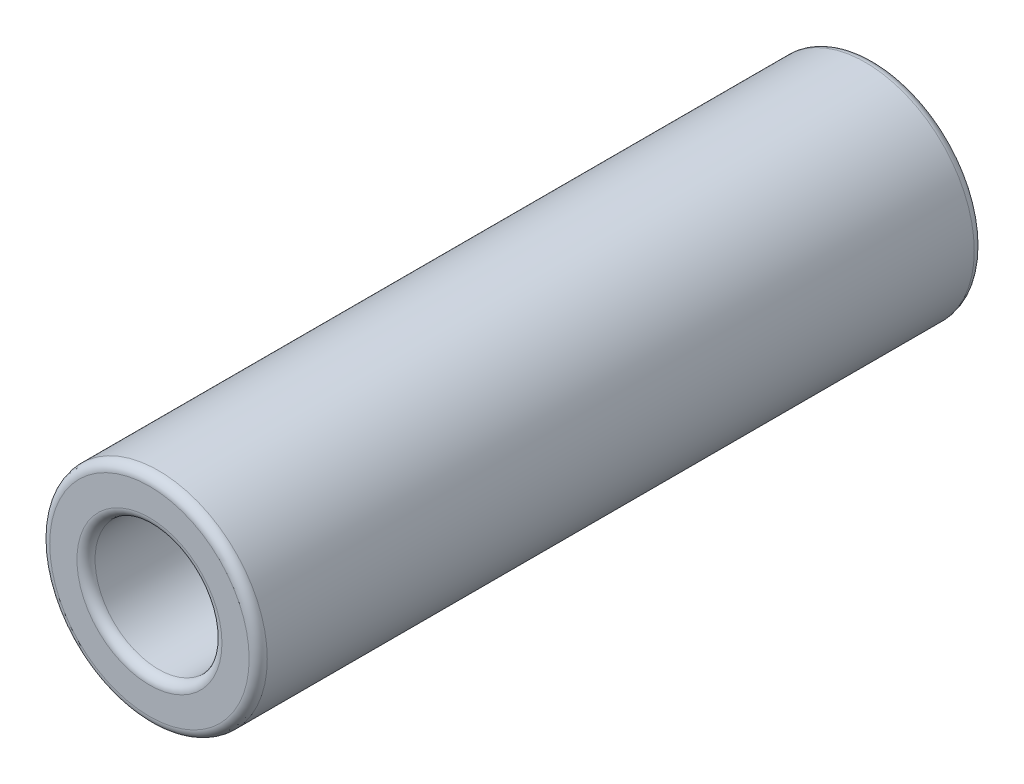
from build123d import *

# Parameters (mm, degrees)
SZKIC1_R                    = 6
SZKIC1_R_2                  = 3.5
DODANIE_WYCI_GNI_CIE1_DEPTH = 40
ZAOKR_GLENIE1_R             = 0.5
ZAOKR_GLENIE2_R             = 0.5


with BuildPart() as part:
    # Szkic1 → Dodanie-wyciągnięcie1 (new body)
    with BuildSketch(Plane.XY):
        Circle(SZKIC1_R)
        Circle(SZKIC1_R_2, mode=Mode.SUBTRACT)
    extrude(amount=DODANIE_WYCI_GNI_CIE1_DEPTH)

    # Zaokrąglenie1
    zaokr_glenie1_edges = [part.edges().sort_by_distance(p)[0] for p in [
        (-6, 0, 0),
        (-3.5, 0, 0),
    ]]
    fillet(zaokr_glenie1_edges, radius=ZAOKR_GLENIE1_R)

    # Zaokrąglenie2
    zaokr_glenie2_edges = [part.edges().sort_by_distance(p)[0] for p in [
        (-6, 0, 40),
        (-3.5, 0, 40),
    ]]
    fillet(zaokr_glenie2_edges, radius=ZAOKR_GLENIE2_R)


solid = part.part
